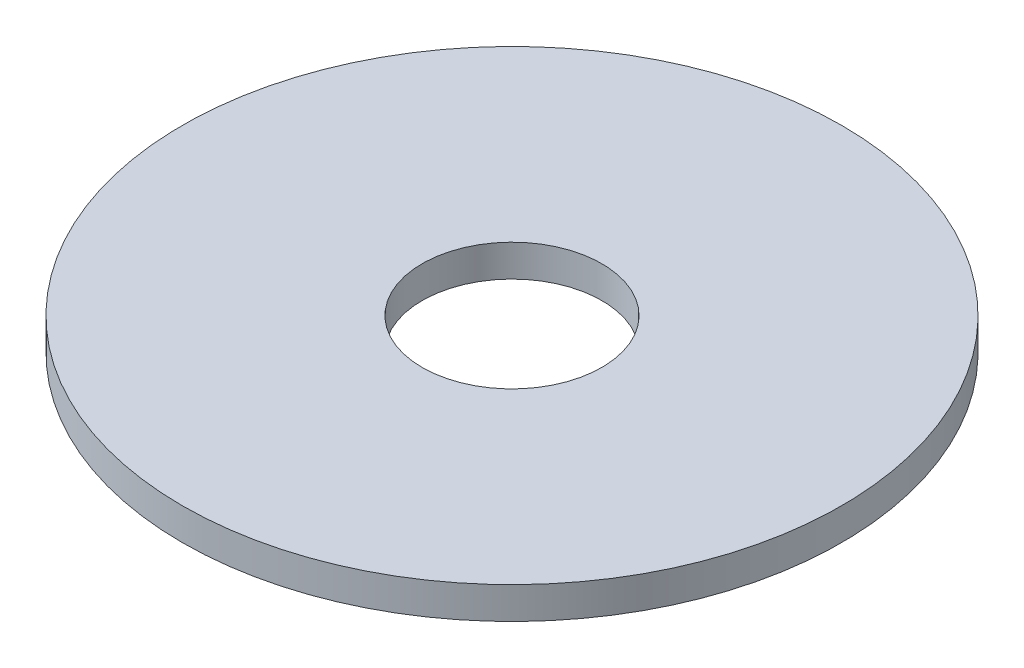
from build123d import *

# Parameters (mm, degrees)
SKETCH1_R           = 8.25
BOSS_EXTRUDE1_DEPTH = 0.8
SKETCH2_R           = 2.25
CUT_EXTRUDE1_DEPTH  = 5


with BuildPart() as part:
    # Sketch1 → Boss-Extrude1 (new body)
    with BuildSketch(Plane(origin=(0, 0, 0), x_dir=(1, 0, 0), z_dir=(0, 1, 0))):
        with Locations(Location((0, 0, 0), (0, 0, 270))):
            Circle(SKETCH1_R)
    extrude(amount=BOSS_EXTRUDE1_DEPTH)

    # Sketch2 → Cut-Extrude1 (cut)
    with BuildSketch(Plane(origin=(0, 0.8, 0), x_dir=(1, 0, 0), z_dir=(0, 1, 0))):
        with Locations(Location((0, 0, 0), (0, 0, 270))):
            Circle(SKETCH2_R)
    extrude(amount=-CUT_EXTRUDE1_DEPTH, mode=Mode.SUBTRACT)


solid = part.part
